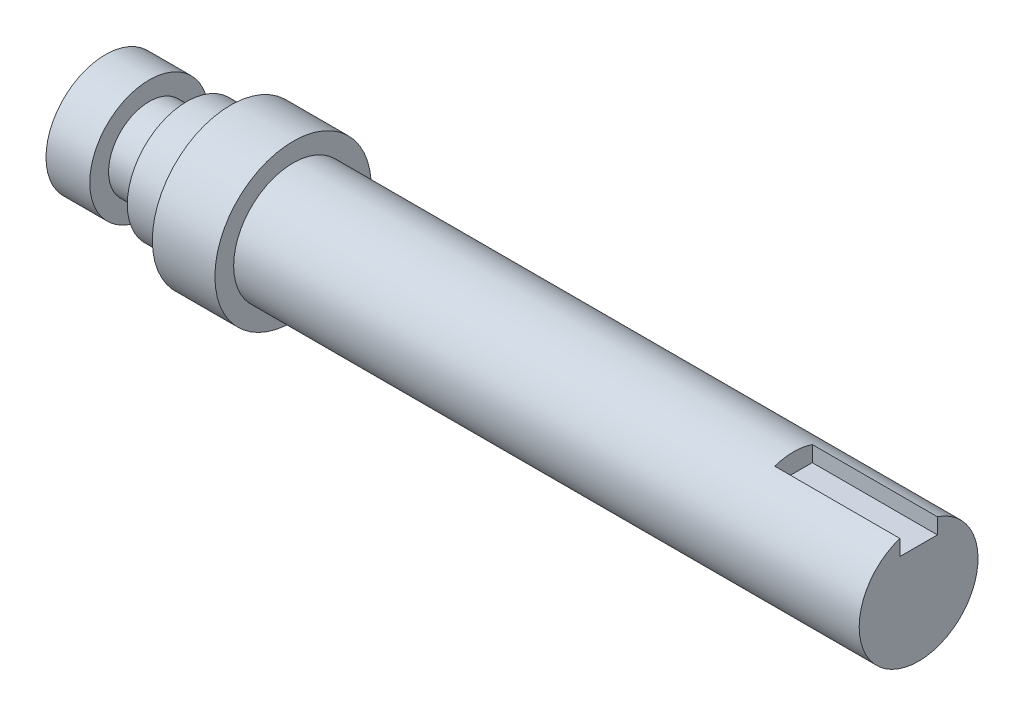
from build123d import *

# Parameters (mm, degrees)
SKETCH2_W          = 6
SKETCH2_H          = 3
SKETCH3_W          = 20
SKETCH3_H          = 3
CUT_EXTRUDE1_DEPTH = 3


with BuildPart() as part:
    # Sketch1 → Revolve1 (revolve)
    with BuildSketch(Plane.XY, mode=Mode.PRIVATE) as revolve1_sk:
        Polygon((-110, 9.5), (-110, 12.5), (-100, 12.5), (-100, 9.5), (0, 9.5), (0, 0), (-130, 0), (-130, 9.5), align=None)
    revolve(revolve1_sk.sketch.rotate(Axis((0.866713413, 0, 0), (1, 0, 0)), 90), axis=Axis((0.866713413, 0, 0), (1, 0, 0)))

    # Sketch2 → Cut-Revolve1 (revolve, cut)
    with BuildSketch(Plane.XY, mode=Mode.PRIVATE) as cut_revolve1_sk:
        with Locations((-120, 8)):
            Rectangle(SKETCH2_W, SKETCH2_H)
    revolve(cut_revolve1_sk.sketch.rotate(Axis((-130, 0, 0), (1, 0, 0)), 90), axis=Axis((-130, 0, 0), (1, 0, 0)), mode=Mode.SUBTRACT)

    # Sketch3 → Cut-Extrude1 (cut, symmetric)
    with BuildSketch(Plane.XY):
        with Locations((-10, 8)):
            Rectangle(SKETCH3_W, SKETCH3_H)
    extrude(amount=CUT_EXTRUDE1_DEPTH, both=True, mode=Mode.SUBTRACT)


solid = part.part
